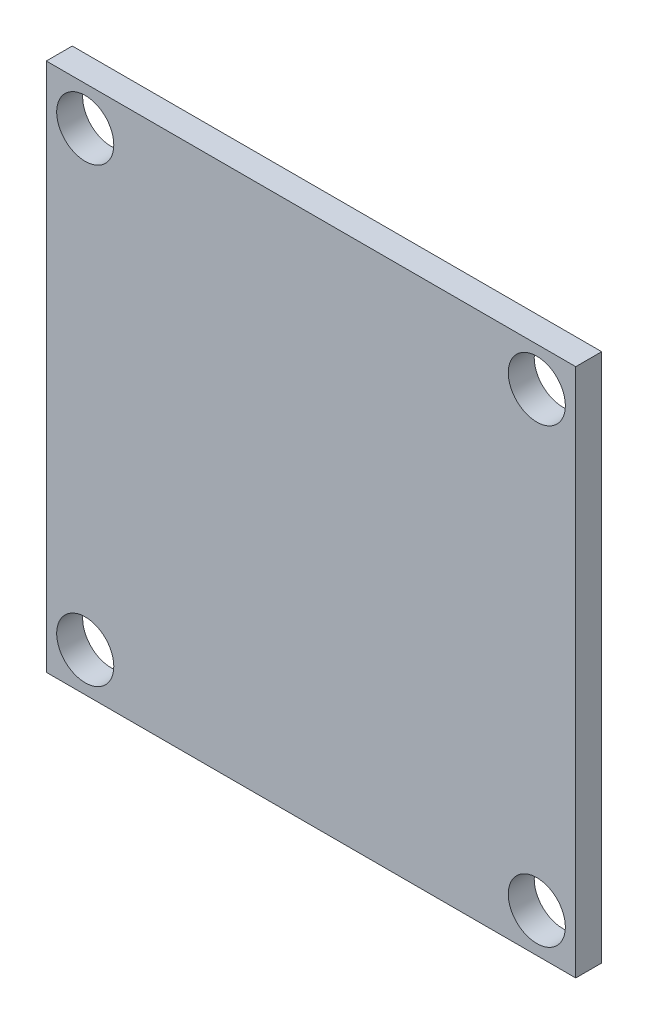
from build123d import *

# Parameters (mm, degrees)
SKETCH1_W           = 51.816
SKETCH1_H           = 51.816
BOSS_EXTRUDE1_DEPTH = 2.54
SKETCH2_R           = 2.794
CUT_EXTRUDE1_DEPTH  = 5.08


with BuildPart() as part:
    # Sketch1 → Boss-Extrude1 (new body)
    with BuildSketch(Plane.XY):
        Rectangle(SKETCH1_W, SKETCH1_H)
    extrude(amount=BOSS_EXTRUDE1_DEPTH)

    # Sketch2 → Cut-Extrude1 (cut)
    with BuildSketch(Plane.XY.offset(2.54)):
        with Locations((22.098, 22.098)):
            Circle(SKETCH2_R)
        with Locations((22.098, -22.098)):
            Circle(SKETCH2_R)
        with Locations((-22.098, 22.098)):
            Circle(SKETCH2_R)
        with Locations((-22.098, -22.098)):
            Circle(SKETCH2_R)
    extrude(amount=-CUT_EXTRUDE1_DEPTH, mode=Mode.SUBTRACT)


solid = part.part
